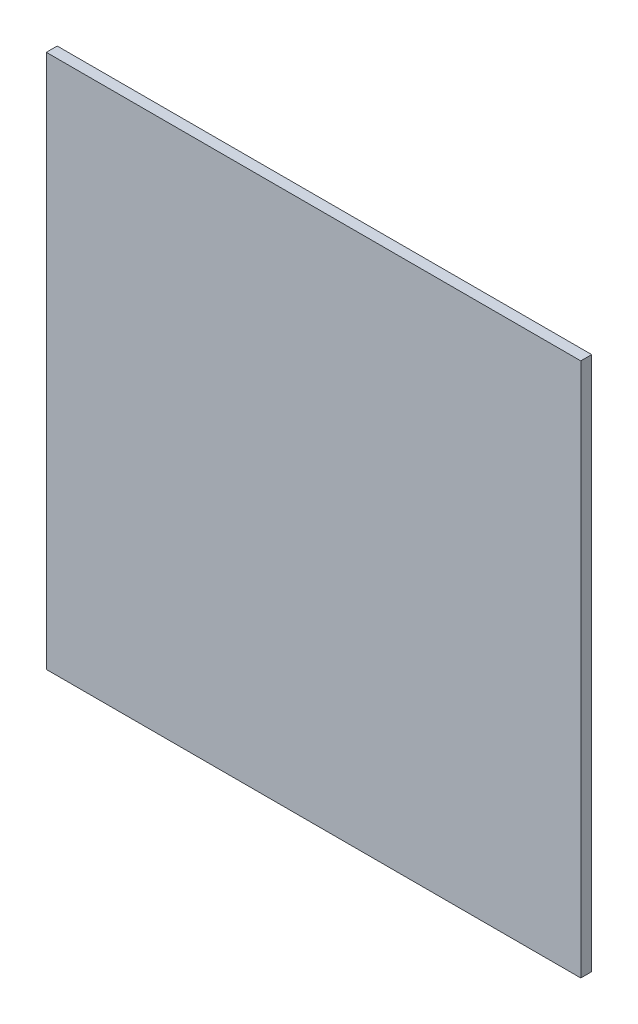
from build123d import *

# Parameters (mm, degrees)
SKETCH_1_W      = 4.9
SKETCH_1_H      = 4.9
EXTRUDE_1_DEPTH = 0.1


with BuildPart() as part:
    # 草图1 → 凸台-拉伸1 (new body)
    with BuildSketch(Plane.XY):
        Rectangle(SKETCH_1_W, SKETCH_1_H)
    extrude(amount=EXTRUDE_1_DEPTH)


solid = part.part
